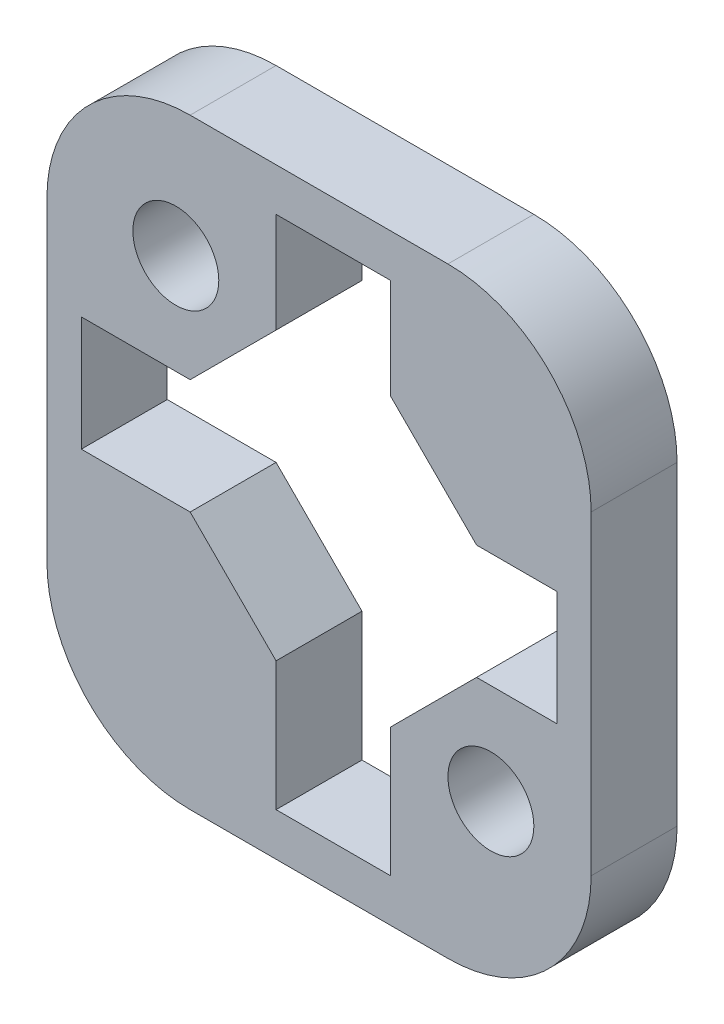
from build123d import *

# Parameters (mm, degrees)
RESSALTO_EXTRUS_O1_DEPTH = 3
CORTE_EXTRUS_O1_DEPTH    = 3
ESBO_O3_R                = 1.5
CORTE_EXTRUS_O2_DEPTH    = 3
CHANFRO1_SIZE            = 3
ESBO_O4_W                = 3
ESBO_O4_H                = 4
RESSALTO_EXTRUS_O2_DEPTH = 0.7
ESBO_O5_W                = 3
ESBO_O5_H                = 4
RESSALTO_EXTRUS_O3_DEPTH = 0.7


with BuildPart() as part:
    # Esboço1 → Ressalto-extrusão1 (new body)
    with BuildSketch(Plane.XY):
        with BuildLine():
            Line((4.5, 10.5), (-4.5, 10.5))
            ThreePointArc((-4.5, 10.5), (-8.035533906, 9.035533906), (-9.5, 5.5))
            Line((-9.5, 5.5), (-9.5, -5.5))
            ThreePointArc((-9.5, -5.5), (-8.035533906, -9.035533906), (-4.5, -10.5))
            Line((-4.5, -10.5), (4.5, -10.5))
            ThreePointArc((4.5, -10.5), (8.035533906, -9.035533906), (9.5, -5.5))
            Line((9.5, -5.5), (9.5, 5.5))
            ThreePointArc((9.5, 5.5), (8.035533906, 9.035533906), (4.5, 10.5))
        make_face()
    extrude(amount=RESSALTO_EXTRUS_O1_DEPTH)

    # Esboço2 → Corte-extrusão1 (cut)
    with BuildSketch(Plane(origin=(0, 0, 0), x_dir=(-1, 0, 0), z_dir=(0, 0, -1))):
        Polygon((-2.5, -1.5), (-2.5, -9), (1.5, -9), (1.5, -1.5), (9, -1.5), (9, 2.5), (1.5, 2.5), (1.5, 9), (-2.5, 9), (-2.5, 2.5), (-9, 2.5), (-9, -1.5), align=None)
    extrude(amount=-CORTE_EXTRUS_O1_DEPTH, mode=Mode.SUBTRACT)

    # Esboço3 → Corte-extrusão2 (cut)
    with BuildSketch(Plane.XY.offset(3)):
        with Locations((6, -5)):
            Circle(ESBO_O3_R)
        with Locations((-5, 6)):
            Circle(ESBO_O3_R)
    extrude(amount=-CORTE_EXTRUS_O2_DEPTH, mode=Mode.SUBTRACT)

    # Chanfro1
    chanfro1_edges = [part.edges().sort_by_distance(p)[0] for p in [
        (2.5, -1.5, 1.5),
        (2.5, 2.5, 1.5),
        (-1.5, 2.5, 1.5),
        (-1.5, -1.5, 1.5),
    ]]
    chamfer(chanfro1_edges, length=CHANFRO1_SIZE)

    # Esboço4 → Ressalto-extrusão2 (add)
    with BuildSketch(Plane(origin=(-9, 0, 0), x_dir=(0, 0, -1), z_dir=(1, 0, 0))):
        with Locations((-1.5, 0.5)):
            Rectangle(ESBO_O4_W, ESBO_O4_H)
    extrude(amount=RESSALTO_EXTRUS_O2_DEPTH)

    # Esboço5 → Ressalto-extrusão3 (add)
    with BuildSketch(Plane.ZY.offset(-9)):
        with Locations((1.5, 0.5)):
            Rectangle(ESBO_O5_W, ESBO_O5_H)
    extrude(amount=RESSALTO_EXTRUS_O3_DEPTH)


solid = part.part
